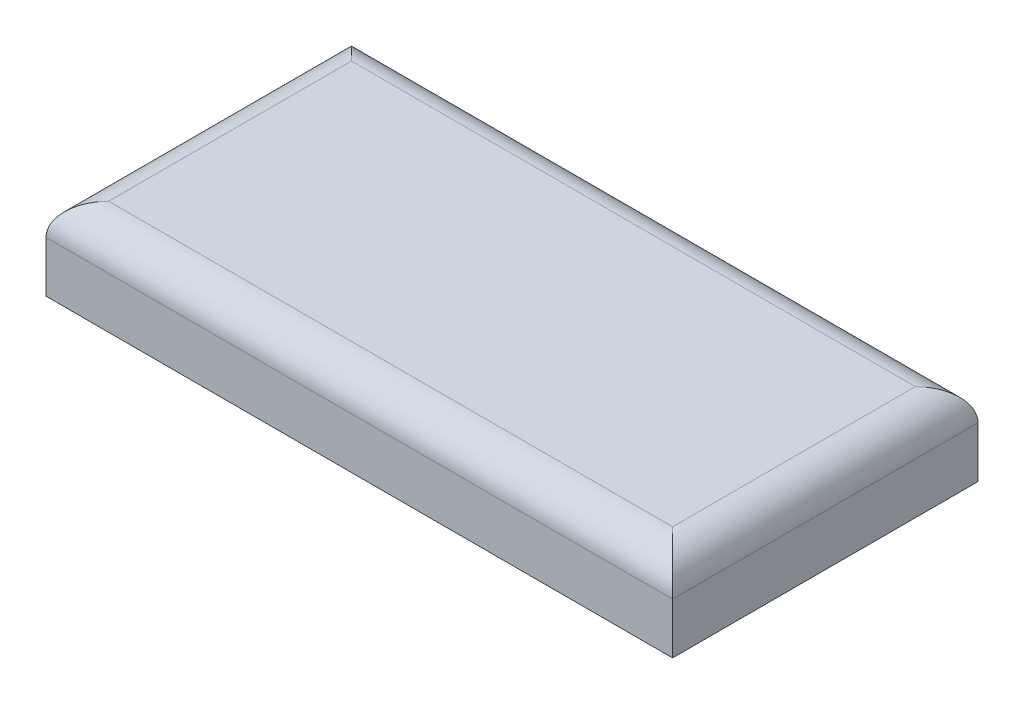
from build123d import *

# Parameters (mm, degrees)
SKETCH1_W           = 80
SKETCH1_H           = 39
SKETCH1_W_2         = 77
SKETCH1_H_2         = 36
BOSS_EXTRUDE1_DEPTH = 9
SKETCH2_W           = 80
SKETCH2_H           = 39
BOSS_EXTRUDE2_DEPTH = 1.5
SKETCH4_W           = 78.5
SKETCH4_H           = 37.5
CUT_EXTRUDE1_DEPTH  = 1
FILLET1_R           = 4
CUT_EXTRUDE2_REACH  = 58.844


with BuildPart() as part:
    # Sketch1 → Boss-Extrude1 (new body)
    with BuildSketch(Plane(origin=(0, 0, 0), x_dir=(1, 0, 0), z_dir=(0, 1, 0))):
        Rectangle(SKETCH1_W, SKETCH1_H)
        Rectangle(SKETCH1_W_2, SKETCH1_H_2, mode=Mode.SUBTRACT)
    extrude(amount=BOSS_EXTRUDE1_DEPTH)

    # Sketch2 → Boss-Extrude2 (add)
    with BuildSketch(Plane(origin=(0, 9, 0), x_dir=(1, 0, 0), z_dir=(0, 1, 0))):
        Rectangle(SKETCH2_W, SKETCH2_H)
    extrude(amount=BOSS_EXTRUDE2_DEPTH)

    # Sketch4 → Cut-Extrude1 (cut)
    with BuildSketch(Plane.XZ):
        Rectangle(SKETCH4_W, SKETCH4_H)
    extrude(amount=-CUT_EXTRUDE1_DEPTH, mode=Mode.SUBTRACT)

    # Fillet1
    fillet1_edges = [part.edges().sort_by_distance(p)[0] for p in [
        (-40, 10.5, 0),
        (0, 10.5, 19.5),
        (40, 10.5, 0),
        (0, 10.5, -19.5),
    ]]
    fillet(fillet1_edges, radius=FILLET1_R)

    # Sketch5 → Cut-Extrude2 (cut, up to next)
    with BuildSketch(Plane(origin=(0, 0, -19.5), x_dir=(-1, 0, 0), z_dir=(0, 0, -1)), mode=Mode.PRIVATE) as cut_extrude2_sk1:
        with BuildLine():
            Line((34.5, -3), (34.5, 3))
            ThreePointArc((34.5, 3), (36.5, 5), (38.5, 3))
            Line((38.5, 3), (38.5, -3))
            ThreePointArc((38.5, -3), (36.5, -5), (34.5, -3))
        make_face()
    cut_extrude2_tool1 = extrude(cut_extrude2_sk1.sketch, amount=-CUT_EXTRUDE2_REACH, mode=Mode.PRIVATE) & part.part
    add(cut_extrude2_tool1.solids().sort_by_distance((-36.5, 0, -19.5))[0], mode=Mode.SUBTRACT)


solid = part.part
